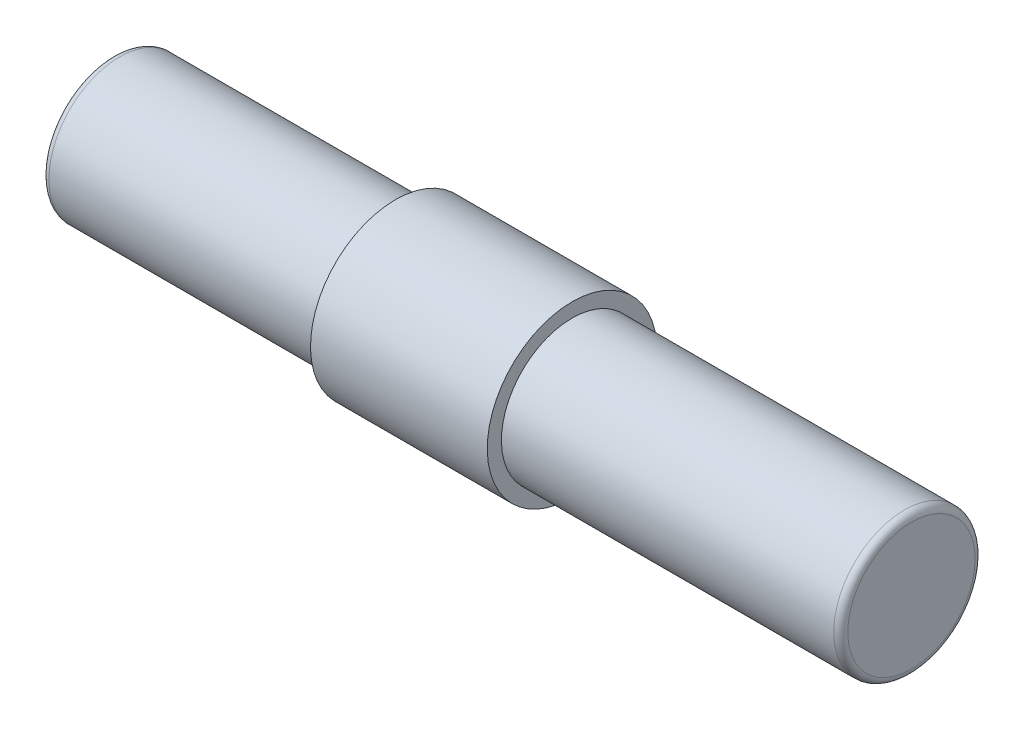
from build123d import *

# Parameters (mm, degrees)
VERRUNDUNG1_R = 0.5


with BuildPart() as part:
    # Skizze1 → Rotation1 (revolve)
    with BuildSketch(Plane.XY):
        Polygon((-57.468382115, 0), (-57.468382115, 5), (-37.468382115, 5), (-37.468382115, 6), (-24.968382115, 6), (-24.968382115, 5), (-0.968382115, 5), (-0.968382115, 0), align=None)
    revolve(axis=Axis((-0.968382115, 0, 0), (-1, 0, 0)))

    # Verrundung1
    verrundung1_edges = [part.edges().sort_by_distance(p)[0] for p in [
        (-0.968382115, -5, 0),
        (-57.468382115, -5, 0),
    ]]
    fillet(verrundung1_edges, radius=VERRUNDUNG1_R)


solid = part.part
